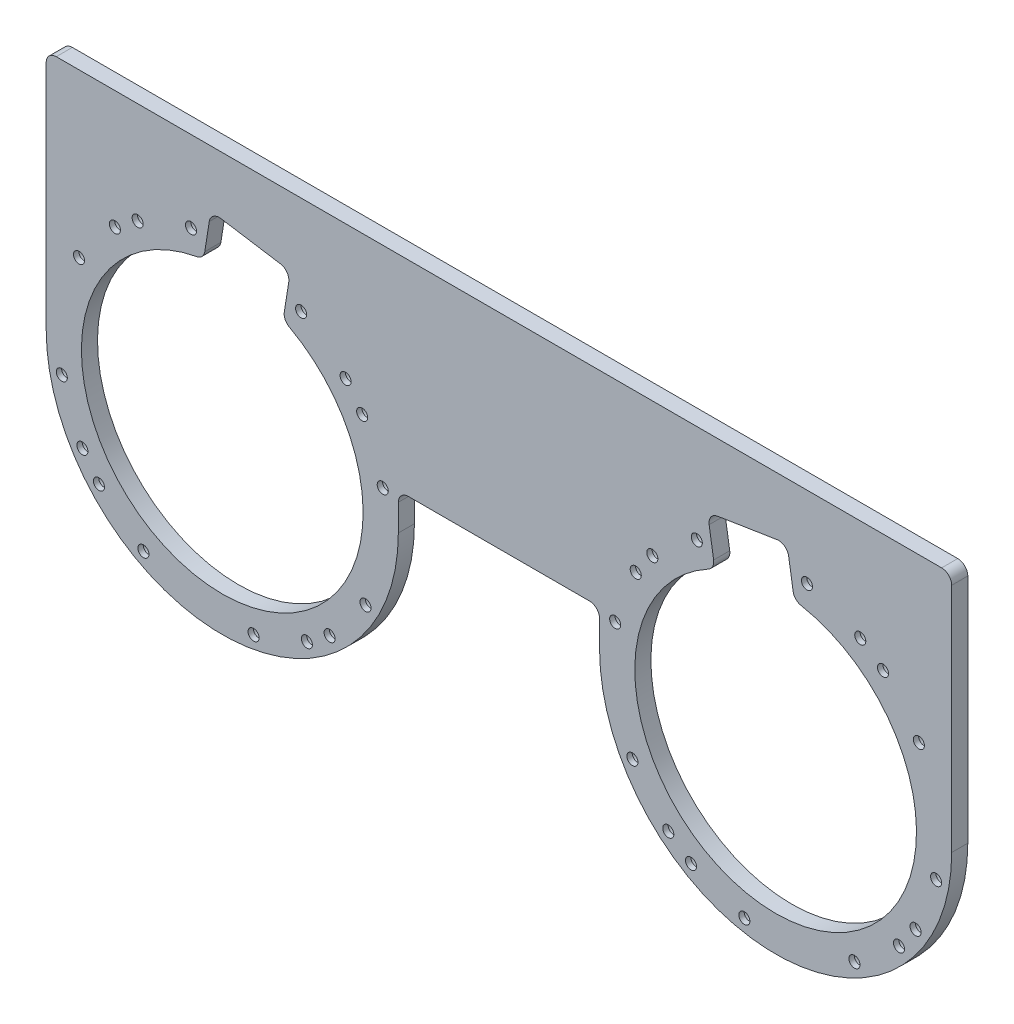
from build123d import *

# Parameters (mm, degrees)
SKETCH_1_R               = 87.5
SKETCH_1_R_2             = 70
EXTRUDE_1_DEPTH          = 8
SKETCH_2_R               = 2.75
CUT_EXTRUDE_1_DEPTH      = 10
PATTERN_CIRCULAR_1_COUNT = 4
EXTRUDE_START            = -8
EXTRUDE_3_DEPTH          = 8
MM_1_D                   = 10
MM_1_DEPTH               = 4
MM_1_TIP                 = 3.004303095
SKETCH_6_W               = 50
SKETCH_6_H               = 101.776404105
EXTRUDE_4_DEPTH          = 8
CUT_EXTRUDE_2_DEPTH      = 10
FILLET_1_R               = 5


with BuildPart() as part:
    # 草图1 → 凸台-拉伸1 (new body)
    with BuildSketch(Plane.XY):
        Circle(SKETCH_1_R)
        Circle(SKETCH_1_R_2, mode=Mode.SUBTRACT)
    extrude(amount=EXTRUDE_1_DEPTH)

    # 草图2 → 切除-拉伸1 (cut)
    with BuildSketch(Plane.XY.offset(8)):
        with Locations((42.051550898, 69.52143243)):
            Circle(SKETCH_2_R)
        with Locations((53.351997363, 61.27909005)):
            Circle(SKETCH_2_R)
        with Locations((71.178427561, 39.181551143)):
            Circle(SKETCH_2_R)
        with Locations((15.564640034, 79.745247386)):
            Circle(SKETCH_2_R)
    cut_extrude_1 = extrude(amount=-CUT_EXTRUDE_1_DEPTH, mode=Mode.SUBTRACT)

    # 阵列(圆周)1: 切除-拉伸1 ×4 about axis
    pattern_circular_1_axis = Axis((0, 0, 0), (0, 0, 1))
    for i in range(1, PATTERN_CIRCULAR_1_COUNT):
        add(cut_extrude_1.rotate(pattern_circular_1_axis, i * 360 / PATTERN_CIRCULAR_1_COUNT), mode=Mode.SUBTRACT)

    # 草图4 → 凸台-拉伸3 (add)
    with BuildSketch(Plane.XY.offset(8).offset(EXTRUDE_START)):
        with BuildLine():
            Line((87.5, 120), (87.5, 0))
            ThreePointArc((87.5, 0), (0, 87.5), (-87.5, 0))
            Line((-87.5, 0), (-87.5, 120))
            Line((-87.5, 120), (87.5, 120))
        make_face()
    extrude(amount=EXTRUDE_3_DEPTH)

    # 大小mm 暗销孔1
    with Locations(Plane(origin=(71.178427561, 39.181551143, 0), x_dir=(-1, 0, 0), z_dir=(0, 0, -1))):
        with Locations((0, 0), (17.826430198, 22.097538907), (29.126876663, 30.339881287), (55.613787527, 40.563696243), (110.359978704, 31.996876418), (132.457517611, 14.17044622), (140.699859991, 2.869999755), (150.923674947, -23.616911109), (142.356855122, -78.363102286), (124.530424924, -100.460641193), (113.229978459, -108.702983573), (86.743067595, -118.926798529), (31.996876418, -110.359978704), (9.899337511, -92.533548506), (1.656995131, -81.233102041), (-8.566819825, -54.746191177)):
            Hole(MM_1_D / 2, depth=MM_1_DEPTH)
            with Locations((0, 0, -(MM_1_DEPTH + MM_1_TIP / 2))):  # 118° drill point
                Cone(0, MM_1_D / 2, MM_1_TIP, mode=Mode.SUBTRACT)

    # 草图6 → 凸台-拉伸4 (add)
    with BuildSketch(Plane.XY.offset(8)):
        with Locations((-112.5, 69.111797948)):
            Rectangle(SKETCH_6_W, SKETCH_6_H)
    extrude(amount=-EXTRUDE_4_DEPTH)

    # 草图7 → 切除-拉伸2 (cut)
    with BuildSketch(Plane(origin=(0, 0, 0), x_dir=(-1, 0, 0), z_dir=(0, 0, -1))):
        Polygon((-10.430849452, 61.991272902), (-5.674664958, 92.020639954), (33.832868666, 85.763261353), (29.076684172, 55.7338943), align=None)
    extrude(amount=-CUT_EXTRUDE_2_DEPTH, mode=Mode.SUBTRACT)

    # 圆角1
    fillet_1_edges = [part.edges().sort_by_distance(p)[0] for p in [
        (-87.5, 18.223595895, 4),
        (-30.247709748, 63.127458804, 4),
        (9.259823876, 69.384837405, 4),
        (5.674664958, 92.020639954, 4),
        (-33.832868666, 85.763261353, 4),
        (87.5, 120, 4),
    ]]
    fillet(fillet_1_edges, radius=FILLET_1_R)

    # 镜向10: part across plane


with BuildPart() as part_1:
    add(part.part)
    add(part.part.mirror(Plane(origin=(-137.5, 120, -113.39504589), x_dir=(0, 0, 1), z_dir=(-1, 0, 0))))


solid = part_1.part
